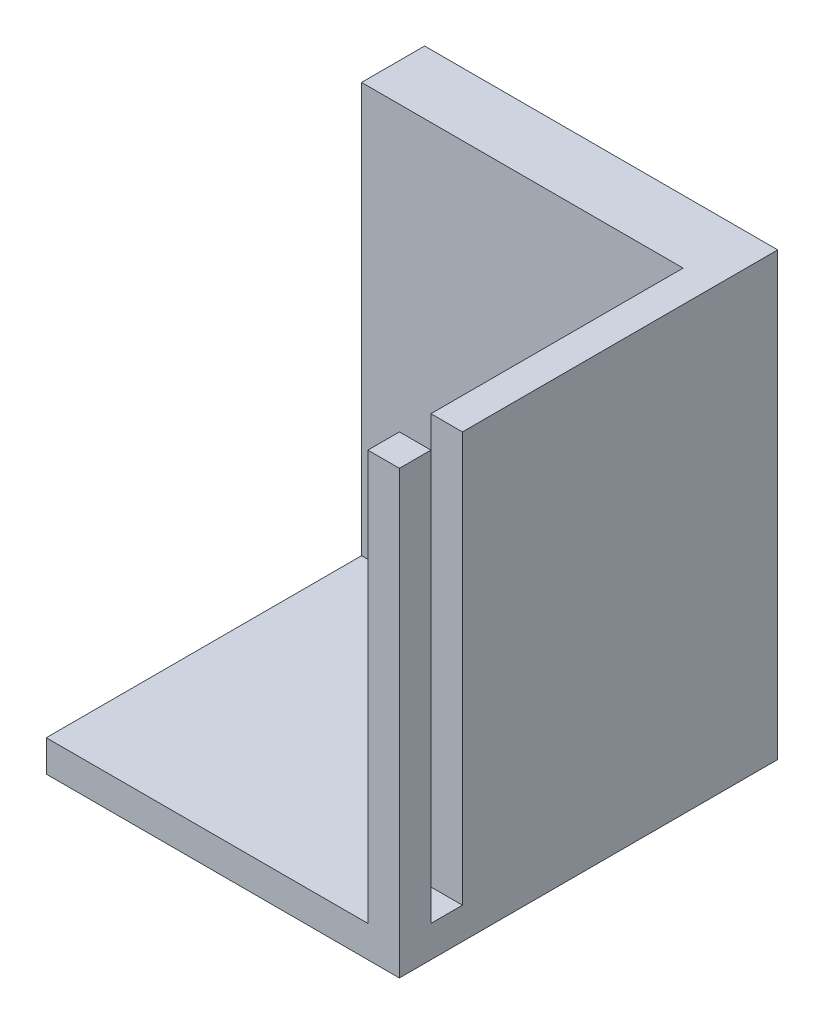
from build123d import *

# Parameters (mm, degrees)
SKETCH1_W                      = 670
SKETCH1_H                      = 120
BOSS_EXTRUDE1_DEPTH            = 530
SKETCH2_W                      = 100
SKETCH2_H                      = 200
SKETCH2_W_2                    = 650
SKETCH2_H_2                    = 250
CUT_EXTRUDE1_DEPTH             = 100
SKETCH3_R                      = 50
CUT_EXTRUDE2_DEPTH             = 260
F_12_0_12_DIAMETER_HOLE2_D     = 12
F_12_0_12_DIAMETER_HOLE2_DEPTH = 30
F_12_0_12_DIAMETER_HOLE2_TIP   = 3.605163714
SKETCH8_W                      = 650
SKETCH8_H                      = 50
BOSS_EXTRUDE2_DEPTH            = 5
SKETCH9_W                      = 10
SKETCH9_H                      = 250
CUT_EXTRUDE3_DEPTH             = 717
CUT_EXTRUDE4_DEPTH             = 5
SKETCH11_W                     = 10
SKETCH11_H                     = 100
BOSS_EXTRUDE3_DEPTH            = 78
BOSS_EXTRUDE3_2_DEPTH          = 78
BOSS_EXTRUDE3_3_DEPTH          = 78
SKETCH12_W                     = 20
SKETCH12_H                     = 30
CUT_EXTRUDE5_DEPTH             = 80
SKETCH15_W                     = 30
SKETCH15_H                     = 23.536156656
SKETCH15_H_2                   = 28.986603691
CUT_EXTRUDE7_DEPTH             = 35
SHELL1_T                       = -3
SKETCH16_W                     = 14
SKETCH16_H                     = 14
CUT_EXTRUDE8_DEPTH             = 35
SKETCH17_W                     = 5.729882812
SKETCH17_H                     = 17.428393554
SKETCH17_W_2                   = 13.369726562
SKETCH17_H_2                   = 3.342431641
BOSS_EXTRUDE4_DEPTH            = 5
CUT_EXTRUDE10_DEPTH            = 863.670273187
CUT_EXTRUDE10_DEPTH_BACK       = 863.670273187
SKETCH18_W                     = 670
SKETCH18_H                     = 250
CUT_EXTRUDE12_DEPTH            = 737.002717386
CUT_EXTRUDE12_DEPTH_BACK       = 737.002717386
SKETCH19_W                     = 558
SKETCH19_H                     = 280
CUT_EXTRUDE13_DEPTH            = 322.253793752
CUT_EXTRUDE13_DEPTH_BACK       = 322.253793752
SKETCH20_W                     = 120
SKETCH20_H                     = 140


with BuildPart() as part:
    # Sketch1 → Boss-Extrude1 (new body)
    with BuildSketch(Plane(origin=(0, 0, 0), x_dir=(1, 0, 0), z_dir=(0, 1, 0))):
        with Locations((335, 60)):
            Rectangle(SKETCH1_W, SKETCH1_H)
    extrude(amount=BOSS_EXTRUDE1_DEPTH)

    # Sketch2 → Cut-Extrude1 (cut)
    with BuildSketch(Plane.XY):
        with Locations((60, 380)):
            Rectangle(SKETCH2_W, SKETCH2_H)
        with Locations((170, 380)):
            Rectangle(SKETCH2_W, SKETCH2_H)
        with Locations((280, 380)):
            Rectangle(SKETCH2_W, SKETCH2_H)
        with Locations((390, 380)):
            Rectangle(SKETCH2_W, SKETCH2_H)
        with Locations((500, 380)):
            Rectangle(SKETCH2_W, SKETCH2_H)
        with Locations((610, 380)):
            Rectangle(SKETCH2_W, SKETCH2_H)
        with Locations((335, 135)):
            Rectangle(SKETCH2_W_2, SKETCH2_H_2)
    extrude(amount=-CUT_EXTRUDE1_DEPTH, mode=Mode.SUBTRACT)

    # Sketch3 → Cut-Extrude2 (cut)
    with BuildSketch(Plane(origin=(0, 530, 0), x_dir=(1, 0, 0), z_dir=(0, 1, 0))):
        with Locations(Location((60, 60, 0), (0, 0, 270))):
            Circle(SKETCH3_R)
        with Locations(Location((170, 60, 0), (0, 0, 270))):
            Circle(SKETCH3_R)
        with Locations(Location((280, 60, 0), (0, 0, 270))):
            Circle(SKETCH3_R)
        with Locations(Location((390, 60, 0), (0, 0, 270))):
            Circle(SKETCH3_R)
        with Locations(Location((500, 60, 0), (0, 0, 270))):
            Circle(SKETCH3_R)
        with Locations(Location((610, 60, 0), (0, 0, 270))):
            Circle(SKETCH3_R)
    extrude(amount=-CUT_EXTRUDE2_DEPTH, mode=Mode.SUBTRACT)

    # Ø12.0 (12) Diameter Hole2
    with Locations(Plane(origin=(59.704642413, 270, -102.411697903), x_dir=(0, 0, 1), z_dir=(0, 1, 0))):
        with Locations((0, 0), (-0.195888006, 111.8520513), (0.014838595, 221.167624818), (-0.341843303, 331.364008353), (0.657723149, 441.008646429), (1.288998006, 549.811854685)):
            Hole(F_12_0_12_DIAMETER_HOLE2_D / 2, depth=F_12_0_12_DIAMETER_HOLE2_DEPTH)
            with Locations((0, 0, -(F_12_0_12_DIAMETER_HOLE2_DEPTH + F_12_0_12_DIAMETER_HOLE2_TIP / 2))):  # 118° drill point
                Cone(0, F_12_0_12_DIAMETER_HOLE2_D / 2, F_12_0_12_DIAMETER_HOLE2_TIP, mode=Mode.SUBTRACT)

    # Sketch8 → Boss-Extrude2 (add)
    with BuildSketch(Plane.XY):
        with Locations((335, 305)):
            Rectangle(SKETCH8_W, SKETCH8_H)
    extrude(amount=-BOSS_EXTRUDE2_DEPTH)

    # Sketch9 → Cut-Extrude3 (cut)
    with BuildSketch(Plane(origin=(670, 0, 0), x_dir=(0, 0, -1), z_dir=(1, 0, 0))):
        with Locations((15, 135)):
            Rectangle(SKETCH9_W, SKETCH9_H)
    extrude(amount=-CUT_EXTRUDE3_DEPTH, mode=Mode.SUBTRACT)

    # Sketch10 → Cut-Extrude4 (cut)
    with BuildSketch(Plane(origin=(0, 10, 0), x_dir=(1, 0, 0), z_dir=(0, 1, 0))):
        Polygon((365, 61.943560596), (350, 87.924322709), (320, 87.924322709), (305, 61.943560596), (320, 35.962798482), (350, 35.962798482), align=None)
    extrude(amount=-CUT_EXTRUDE4_DEPTH, mode=Mode.SUBTRACT)

    # Sketch12 → Cut-Extrude5 (cut)
    with BuildSketch(Plane.XY.offset(-100)):
        with Locations((85.198613037, 245)):
            Rectangle(SKETCH12_W, SKETCH12_H)
        with Locations((195.198613037, 245)):
            Rectangle(SKETCH12_W, SKETCH12_H)
        with Locations((305.198613037, 245)):
            Rectangle(SKETCH12_W, SKETCH12_H)
        with Locations((415.198613037, 245)):
            Rectangle(SKETCH12_W, SKETCH12_H)
        with Locations((525.198613037, 245)):
            Rectangle(SKETCH12_W, SKETCH12_H)
        with Locations((635.198613037, 245)):
            Rectangle(SKETCH12_W, SKETCH12_H)
    extrude(amount=-CUT_EXTRUDE5_DEPTH, mode=Mode.SUBTRACT)

    # Sketch17 → Boss-Extrude4 (add)
    # profile 1 of 9: a face of its own
    with BuildSketch(Plane.XY):
        with BuildLine():
            Line((527.508830928, 289.835452458), (527.508830928, 307.263846012))
            Line((527.508830928, 307.263846012), (534.861434459, 307.263846012))
            add(Edge.make_bspline(
                [(534.861434459, 307.263846012), (535.181337774, 307.258256848), (535.803061116, 307.24739446), (536.703508491, 307.139069344), (537.544992916, 306.975202489), (538.325061607, 306.737496792), (539.040841948, 306.426020155), (539.698044515, 306.051894954), (540.290333057, 305.605079277), (540.822348212, 305.090232636), (541.284521701, 304.502523111), (541.692171296, 303.852565801), (542.030284458, 303.129762281), (542.309377095, 302.341316546), (542.5243908, 301.484161689), (542.679660381, 300.560045938), (542.773357357, 299.567500804), (542.783368073, 298.883107022), (542.788518428, 298.530997273)],
                knots=[0, 0, 0, 0, 1.135059408, 2.20595691, 3.214417064, 4.174978569, 5.094187092, 5.980001006, 6.853065862, 7.720814779, 8.600404634, 9.50058483, 10.438414914, 11.426825708, 12.465239141, 13.571113463, 14.750376389, 16, 16, 16, 16], degree=3))
            add(Edge.make_bspline(
                [(542.788518428, 298.530997273), (542.781740751, 298.180151665), (542.768592871, 297.499553336), (542.676885992, 296.511518461), (542.516733301, 295.591080531), (542.296748778, 294.736450427), (542.003051046, 293.953120444), (541.654236167, 293.233205539), (541.233025793, 292.585291498), (540.753136904, 292.000029304), (540.204772188, 291.484681411), (539.587651059, 291.044279297), (538.910779309, 290.668464036), (538.169670382, 290.361903209), (537.364073889, 290.124869172), (536.495133477, 289.954199984), (535.562644449, 289.853487388), (534.920131033, 289.841584621), (534.58911581, 289.835452458)],
                knots=[0, 0, 0, 0, 1.228418252, 2.382983832, 3.470276728, 4.496757894, 5.468023682, 6.394867725, 7.292157164, 8.167372942, 9.039072913, 9.918728341, 10.815246345, 11.744296628, 12.720973084, 13.750736166, 14.841206188, 16, 16, 16, 16], degree=3))
            Line((534.58911581, 289.835452458), (527.508830928, 289.835452458))
        make_face()
        with BuildLine():
            Line((533.238713741, 291.745413395), (534.048208904, 291.745413395))
            add(Edge.make_bspline(
                [(534.048208904, 291.745413395), (534.172894012, 291.749291978), (534.413033311, 291.756761998), (534.758676231, 291.825976613), (535.075745017, 291.938271137), (535.365749176, 292.094802589), (535.623404602, 292.300450923), (535.848862806, 292.551404902), (536.04776914, 292.844737637), (536.217685755, 293.190205032), (536.364284647, 293.596533622), (536.481764702, 294.076367921), (536.592118304, 294.630928744), (536.673672739, 295.265507643), (536.740044562, 295.978448886), (536.788346679, 296.768428292), (536.812018936, 297.636801208), (536.817188964, 298.241258393), (536.819890499, 298.55711002)],
                knots=[0, 0, 0, 0, 0.728710832, 1.403472396, 2.052289494, 2.690292559, 3.321919393, 3.970736491, 4.656696891, 5.388631723, 6.217040872, 7.17856157, 8.275589967, 9.523440737, 10.918935818, 12.463926104, 14.152268318, 16, 16, 16, 16], degree=3))
            add(Edge.make_bspline(
                [(536.819890499, 298.55711002), (536.8171426, 298.871715251), (536.811863063, 299.476166083), (536.7886758, 300.343334385), (536.739579947, 301.133216935), (536.674703848, 301.843934916), (536.589660404, 302.476324031), (536.488366458, 303.031681737), (536.362441588, 303.507627045), (536.222158727, 303.914921549), (536.050140993, 304.256514038), (535.858357073, 304.554097881), (535.62547107, 304.79746827), (535.36991257, 305.004888479), (535.079348843, 305.160875844), (534.761320266, 305.273944358), (534.414185903, 305.34216807), (534.172870641, 305.349893944), (534.048208904, 305.353885075)],
                knots=[0, 0, 0, 0, 1.842836665, 3.540640921, 5.080358154, 6.47765669, 7.719902824, 8.816971715, 9.781579111, 10.601733135, 11.334613876, 12.017393917, 12.666641099, 13.29908421, 13.937911793, 14.587567384, 15.270347425, 16, 16, 16, 16], degree=3))
            Line((534.048208904, 305.353885075), (533.238713741, 305.353885075))
            Line((533.238713741, 305.353885075), (533.238713741, 291.745413395))
        make_face(mode=Mode.SUBTRACT)
    # profile 2 of 9: a face of its own
    with BuildSketch(Plane.XY):
        with Locations((547.563420772, 298.549649235)):
            Rectangle(SKETCH17_W, SKETCH17_H)
    # profile 3 of 9: a face of its own
    with BuildSketch(Plane.XY):
        Polygon((564.514324092, 307.263846012), (564.514324092, 305.115139958), (558.545696163, 305.115139958), (558.545696163, 299.862747379), (563.559343624, 299.862747379), (563.559343624, 297.714041325), (558.545696163, 297.714041325), (558.545696163, 289.835452458), (552.81581335, 289.835452458), (552.81581335, 307.263846012), align=None)
    # profile 4 of 9: a face of its own
    with BuildSketch(Plane.XY):
        Polygon((577.645305538, 307.263846012), (577.645305538, 305.115139958), (571.676677608, 305.115139958), (571.676677608, 299.862747379), (576.690325069, 299.862747379), (576.690325069, 297.714041325), (571.676677608, 297.714041325), (571.676677608, 289.835452458), (565.946794795, 289.835452458), (565.946794795, 307.263846012), align=None)
    # profile 5 of 9: a face of its own
    with BuildSketch(Plane.XY):
        with Locations((584.330168819, 287.448001286)):
            Rectangle(SKETCH17_W_2, SKETCH17_H_2)
    # profile 6 of 9: a face of its own
    with BuildSketch(Plane.XY):
        with BuildLine():
            Line((605.578484249, 307.263846012), (605.578484249, 295.602639195))
            add(Edge.make_bspline(
                [(605.578484249, 295.602639195), (605.574209777, 295.35989389), (605.565919345, 294.889083964), (605.480877158, 294.20653885), (605.349958188, 293.569747554), (605.15926554, 292.978838165), (604.911867049, 292.436847071), (604.616163877, 291.936663973), (604.260702644, 291.487723021), (603.847299908, 291.08966617), (603.386881991, 290.731670113), (602.867295001, 290.425440037), (602.293741958, 290.168488385), (601.66690529, 289.960990771), (600.988052682, 289.797299786), (600.254912883, 289.679078851), (599.467035781, 289.60781007), (598.923618241, 289.60048219), (598.643684673, 289.59670734)],
                knots=[0, 0, 0, 0, 1.108173197, 2.149326602, 3.136215123, 4.073726706, 4.978516626, 5.852185058, 6.72141202, 7.584905625, 8.467554395, 9.379216169, 10.332422268, 11.332766067, 12.390653242, 13.518530507, 14.721707419, 16, 16, 16, 16], degree=3))
            add(Edge.make_bspline(
                [(598.643684673, 289.59670734), (598.373688491, 289.600411437), (597.851346557, 289.607577482), (597.093280473, 289.679448684), (596.387523889, 289.797736542), (595.733050135, 289.960122315), (595.130189942, 290.169220301), (594.579048171, 290.42623041), (594.078350789, 290.732835498), (593.633858028, 291.090104794), (593.234289459, 291.486851767), (592.899913678, 291.940746827), (592.609043638, 292.435866034), (592.375223767, 292.980322997), (592.191754821, 293.570441519), (592.063541006, 294.20666921), (591.983676196, 294.889343196), (591.974661767, 295.359932437), (591.970012569, 295.602639195)],
                knots=[0, 0, 0, 0, 1.258901956, 2.435505865, 3.547148904, 4.59359074, 5.576649289, 6.5183682, 7.424469602, 8.307507093, 9.172751023, 10.042627298, 10.928839176, 11.845659241, 12.799442865, 13.80597989, 14.868432463, 16, 16, 16, 16], degree=3))
            Line((591.970012569, 295.602639195), (591.970012569, 307.263846012))
            Line((591.970012569, 307.263846012), (597.699895381, 307.263846012))
            Line((597.699895381, 307.263846012), (597.699895381, 295.457153889))
            add(Edge.make_bspline(
                [(597.699895381, 295.457153889), (597.700816195, 295.287996189), (597.702584578, 294.963135903), (597.729908723, 294.499051493), (597.768241004, 294.079064133), (597.828226169, 293.705517832), (597.90066041, 293.377063412), (597.989882091, 293.09281535), (598.094998068, 292.852496478), (598.225239063, 292.654232043), (598.380826623, 292.495135011), (598.55368342, 292.353231761), (598.757556996, 292.238543846), (598.987648905, 292.146224908), (599.243380948, 292.070549638), (599.526120553, 292.020376099), (599.83553351, 291.990763905), (600.049971942, 291.986424568), (600.161954402, 291.984158512)],
                knots=[0, 0, 0, 0, 1.622370975, 3.115695595, 4.458049099, 5.666011203, 6.742434742, 7.681714947, 8.519814998, 9.250928664, 9.942747364, 10.646898194, 11.389596108, 12.175933929, 13.021386247, 13.943159715, 14.925891993, 16, 16, 16, 16], degree=3))
            add(Edge.make_bspline(
                [(600.161954402, 291.984158512), (600.283927219, 291.987190593), (600.521124756, 291.993087005), (600.86597014, 292.03390861), (601.187714881, 292.103380086), (601.484890424, 292.205377303), (601.758665297, 292.332852529), (602.012761516, 292.484567923), (602.236391413, 292.674631152), (602.439076761, 292.888441291), (602.620738276, 293.128529789), (602.771757722, 293.399928575), (602.905501548, 293.697121508), (603.005823683, 294.025060118), (603.089837826, 294.379999499), (603.146989706, 294.763086929), (603.186210275, 295.174074524), (603.189394751, 295.457053988), (603.191033077, 295.602639195)],
                knots=[0, 0, 0, 0, 1.083870311, 2.107775948, 3.08105344, 4.003637981, 4.893545291, 5.761570557, 6.624657808, 7.49233129, 8.376387281, 9.291996285, 10.246843261, 11.267344133, 12.334180325, 13.486053461, 14.706643157, 16, 16, 16, 16], degree=3))
            Line((603.191033077, 295.602639195), (603.191033077, 307.263846012))
            Line((603.191033077, 307.263846012), (605.578484249, 307.263846012))
        make_face()
    # profile 7 of 9: a face of its own
    with BuildSketch(Plane.XY):
        with BuildLine():
            Line((619.731593227, 302.015183827), (616.739818477, 301.526502415))
            add(Edge.make_bspline(
                [(616.739818477, 301.526502415), (616.748849224, 301.670726223), (616.765660669, 301.939210177), (616.78429066, 302.312269209), (616.796668381, 302.625642376), (616.798628236, 302.814722915), (616.799504756, 302.899286839)],
                knots=[0, 0, 0, 0, 1.261802504, 2.348944521, 3.261585937, 4, 4, 4, 4], degree=3))
            add(Edge.make_bspline(
                [(616.799504756, 302.899286839), (616.798306068, 303.007660677), (616.795968139, 303.219033721), (616.750451916, 303.523894877), (616.694806916, 303.811547356), (616.604352699, 304.076787391), (616.488181329, 304.320314265), (616.348943917, 304.543955606), (616.184187178, 304.745078709), (615.995833421, 304.928129987), (615.778009957, 305.083200131), (615.536269472, 305.218702836), (615.269765326, 305.333844758), (614.978065514, 305.431346685), (614.660683072, 305.504624438), (614.319025281, 305.556776695), (613.952471696, 305.585673441), (613.699597795, 305.590260771), (613.568984889, 305.592630192)],
                knots=[0, 0, 0, 0, 1.079280541, 2.105035848, 3.067950317, 3.99715044, 4.889989748, 5.753421302, 6.617030865, 7.476358039, 8.364190572, 9.274590025, 10.235106994, 11.254473582, 12.337095886, 13.478601727, 14.697662529, 16, 16, 16, 16], degree=3))
            add(Edge.make_bspline(
                [(613.568984889, 305.592630192), (613.391954632, 305.58912286), (613.059112606, 305.582528579), (612.595688488, 305.495339748), (612.198743126, 305.361419257), (611.87165349, 305.163811893), (611.613188167, 304.909795747), (611.433841092, 304.593316589), (611.323009072, 304.224665915), (611.313400221, 303.959558324), (611.308367061, 303.820693775)],
                knots=[0, 0, 0, 0, 1.294917039, 2.43462794, 3.440028966, 4.347597256, 5.210608309, 6.06356377, 6.985685997, 8, 8, 8, 8], degree=3))
            add(Edge.make_bspline(
                [(611.308367061, 303.820693775), (611.317562032, 303.705133219), (611.336106628, 303.472068433), (611.47315858, 303.132808312), (611.695999602, 302.811560885), (612.009295906, 302.510664216), (612.404107796, 302.221967273), (612.884407504, 301.948533431), (613.450813789, 301.688189695), (613.862519081, 301.536023727), (614.080048656, 301.455624958)],
                knots=[0, 0, 0, 0, 0.716839541, 1.445735977, 2.240793036, 3.131329288, 4.131129903, 5.273471266, 6.559404876, 8, 8, 8, 8], degree=3))
            add(Edge.make_bspline(
                [(614.080048656, 301.455624958), (614.335934702, 301.364918412), (614.834564244, 301.188164095), (615.547657928, 300.88707802), (616.213068388, 300.5749594), (616.829579094, 300.246613346), (617.397833174, 299.90520698), (617.914851624, 299.544556457), (618.386199073, 299.173962102), (618.807001026, 298.783874588), (619.177995113, 298.378100064), (619.4958685, 297.952745357), (619.771807525, 297.51723103), (619.991113975, 297.061458502), (620.169645242, 296.594624218), (620.292698657, 296.11024444), (620.364288243, 295.609761088), (620.37516617, 295.270864226), (620.380681514, 295.099036213)],
                knots=[0, 0, 0, 0, 1.359488612, 2.649152603, 3.874964776, 5.039588756, 6.146130126, 7.193090393, 8.194917302, 9.146793662, 10.063845301, 10.944476293, 11.803344532, 12.641736646, 13.473440096, 14.302714936, 15.139439897, 16, 16, 16, 16], degree=3))
            add(Edge.make_bspline(
                [(620.380681514, 295.099036213), (620.374476075, 294.902306495), (620.362285176, 294.515820995), (620.280160209, 293.948630617), (620.138011896, 293.409496554), (619.938489338, 292.895972278), (619.681049879, 292.411946655), (619.366518754, 291.954381076), (618.996510229, 291.525099427), (618.5710008, 291.128381035), (618.102222518, 290.765302239), (617.587803957, 290.450854345), (617.034458515, 290.187092261), (616.444107988, 289.968993032), (615.81453624, 289.801373099), (615.145337453, 289.685291013), (614.438790193, 289.606619894), (613.954683001, 289.600062276), (613.70700941, 289.59670734)],
                knots=[0, 0, 0, 0, 0.972121714, 1.909782367, 2.824924061, 3.721832975, 4.62620438, 5.527836938, 6.46026819, 7.421000932, 8.398101015, 9.385579713, 10.394244048, 11.422703992, 12.491421888, 13.608778581, 14.776629625, 16, 16, 16, 16], degree=3))
            add(Edge.make_bspline(
                [(613.70700941, 289.59670734), (613.445745367, 289.599650312), (612.939893069, 289.605348413), (612.207608113, 289.66709241), (611.525297432, 289.760984454), (610.893395078, 289.899706116), (610.309273131, 290.072394336), (609.776099392, 290.288320955), (609.295310255, 290.547303481), (608.863217672, 290.843007892), (608.478306623, 291.175775461), (608.148120946, 291.551766865), (607.86942369, 291.967163224), (607.639947144, 292.421521488), (607.466477665, 292.917583541), (607.339164663, 293.449829748), (607.264537999, 294.021332449), (607.254747521, 294.414908557), (607.249700069, 294.617815586)],
                knots=[0, 0, 0, 0, 1.342201143, 2.598733168, 3.773451092, 4.878874364, 5.91991243, 6.900006476, 7.829142054, 8.72062616, 9.585588575, 10.436728592, 11.283829734, 12.149664931, 13.044964919, 13.977937424, 14.957531465, 16, 16, 16, 16], degree=3))
            add(Edge.make_bspline(
                [(607.249700069, 294.617815586), (607.250803815, 294.692425759), (607.253213998, 294.855347393), (607.260452266, 295.122772538), (607.275636683, 295.433682216), (607.29037174, 295.656130545), (607.298195171, 295.774237248)],
                knots=[0, 0, 0, 0, 0.773500207, 1.689044709, 2.77302154, 4, 4, 4, 4], degree=3))
            Line((607.298195171, 295.774237248), (610.36457777, 296.337526509))
            add(Edge.make_bspline(
                [(610.36457777, 296.337526509), (610.326952988, 296.136337493), (610.255606535, 295.754830366), (610.178678473, 295.21219969), (610.124206629, 294.733311493), (610.11767002, 294.435147371), (610.114641475, 294.297001835)],
                knots=[0, 0, 0, 0, 1.192988372, 2.262218769, 3.194850416, 4, 4, 4, 4], degree=3))
            add(Edge.make_bspline(
                [(610.114641475, 294.297001835), (610.116191817, 294.183708768), (610.119182568, 293.965156219), (610.159053378, 293.648552813), (610.215988606, 293.352999663), (610.302906772, 293.079707227), (610.411206928, 292.826307836), (610.544682453, 292.59538211), (610.704385489, 292.386485019), (610.887496571, 292.200099922), (611.094689168, 292.033628705), (611.327456494, 291.892756696), (611.58347653, 291.771733922), (611.864681562, 291.677479524), (612.167961721, 291.596080628), (612.497219749, 291.548235723), (612.849461228, 291.512043782), (613.092629543, 291.508500084), (613.218327999, 291.506668278)],
                knots=[0, 0, 0, 0, 1.135776692, 2.191015738, 3.19649269, 4.151244236, 5.061952528, 5.956281389, 6.819534407, 7.692823504, 8.571441916, 9.478554956, 10.416037156, 11.406231466, 12.450054172, 13.561596327, 14.739541482, 16, 16, 16, 16], degree=3))
            add(Edge.make_bspline(
                [(613.218327999, 291.506668278), (613.423996012, 291.510791273), (613.810619321, 291.518541853), (614.349272542, 291.616708407), (614.810575885, 291.768742445), (615.189785268, 291.991387532), (615.490778961, 292.278756613), (615.698005174, 292.637320004), (615.824813318, 293.05638326), (615.837728413, 293.355975238), (615.844524288, 293.513619419)],
                knots=[0, 0, 0, 0, 1.308765556, 2.460272085, 3.475015317, 4.388076298, 5.239673503, 6.095681635, 6.997954785, 8, 8, 8, 8], degree=3))
            add(Edge.make_bspline(
                [(615.844524288, 293.513619419), (615.833808824, 293.638242951), (615.811807312, 293.894126055), (615.644884004, 294.264515838), (615.382382362, 294.620631473), (615.016807277, 294.962984909), (614.551376589, 295.293471235), (613.986957743, 295.616730224), (613.322148235, 295.933112033), (612.83677959, 296.119639164), (612.580430889, 296.21815395)],
                knots=[0, 0, 0, 0, 0.667930748, 1.371427933, 2.146459016, 3.034714139, 4.04893387, 5.207327294, 6.525042705, 8, 8, 8, 8], degree=3))
            add(Edge.make_bspline(
                [(612.580430889, 296.21815395), (612.374354345, 296.29679374), (611.970646869, 296.450850434), (611.394079385, 296.713586304), (610.853066711, 296.987016804), (610.357486361, 297.288235735), (609.896382561, 297.599610528), (609.477036946, 297.932256792), (609.09841673, 298.284556341), (608.758710772, 298.653375077), (608.457302107, 299.038989264), (608.199448649, 299.444659231), (607.977533299, 299.866789834), (607.798609588, 300.308107488), (607.65975715, 300.767821241), (607.559616231, 301.244439392), (607.497905054, 301.739995674), (607.491630423, 302.075933546), (607.488445186, 302.246468159)],
                knots=[0, 0, 0, 0, 1.249558333, 2.447906163, 3.58867143, 4.682264114, 5.731748367, 6.739728761, 7.711906036, 8.659384707, 9.578321416, 10.481344598, 11.379544271, 12.277135726, 13.175418307, 14.097160112, 15.034047388, 16, 16, 16, 16], degree=3))
            add(Edge.make_bspline(
                [(607.488445186, 302.246468159), (607.49282555, 302.439538736), (607.501402184, 302.817565692), (607.587451154, 303.36980586), (607.719291893, 303.894921371), (607.910558542, 304.389343064), (608.156192894, 304.852853762), (608.453187669, 305.288766511), (608.804241719, 305.697593471), (609.213503754, 306.066686531), (609.657214714, 306.407618241), (610.14376173, 306.697651931), (610.658716537, 306.950861947), (611.210636666, 307.148827868), (611.791820619, 307.313252612), (612.408080529, 307.421140415), (613.056315391, 307.490701612), (613.499160755, 307.498567824), (613.725661373, 307.502591129)],
                knots=[0, 0, 0, 0, 1.01033566, 1.978209831, 2.919499157, 3.840961976, 4.746855014, 5.660740114, 6.597989116, 7.56120833, 8.541877795, 9.523498025, 10.522416858, 11.542172371, 12.589598349, 13.681636521, 14.814234488, 16, 16, 16, 16], degree=3))
            add(Edge.make_bspline(
                [(613.725661373, 307.502591129), (613.968269855, 307.498219033), (614.438190994, 307.489750488), (615.120391152, 307.426787419), (615.755073228, 307.319142339), (616.345153155, 307.171557286), (616.887304575, 306.977590666), (617.384933999, 306.742393454), (617.834452216, 306.46201507), (618.236961315, 306.139451502), (618.593086714, 305.773322851), (618.897467704, 305.361641069), (619.158701245, 304.909408454), (619.366684143, 304.412232174), (619.529870326, 303.873247147), (619.649133834, 303.29158184), (619.720420497, 302.667301443), (619.72779778, 302.236712324), (619.731593227, 302.015183827)],
                knots=[0, 0, 0, 0, 1.248314423, 2.417925914, 3.521398822, 4.558068205, 5.543720209, 6.479599284, 7.385061127, 8.263440163, 9.127722873, 10.00561236, 10.891325273, 11.808802823, 12.772251995, 13.784947978, 14.860405143, 16, 16, 16, 16], degree=3))
        make_face()
    # profile 8 of 9: a face of its own
    with BuildSketch(Plane.XY):
        Polygon((633.989153194, 307.263846012), (633.989153194, 305.115139958), (628.020525264, 305.115139958), (628.020525264, 300.340237614), (633.034172725, 300.340237614), (633.034172725, 298.191531559), (628.020525264, 298.191531559), (628.020525264, 291.984158512), (634.944133663, 291.984158512), (634.944133663, 289.835452458), (622.290642452, 289.835452458), (622.290642452, 307.263846012), align=None)
    # profile 9 of 9: a face of its own
    with BuildSketch(Plane.XY):
        with BuildLine():
            Line((636.376604366, 289.835452458), (636.376604366, 307.263846012))
            Line((636.376604366, 307.263846012), (643.990335369, 307.263846012))
            add(Edge.make_bspline(
                [(643.990335369, 307.263846012), (644.237946498, 307.261150834), (644.721600887, 307.25588639), (645.426490561, 307.189203683), (646.094808274, 307.090496236), (646.724915796, 306.949857504), (647.317873659, 306.767252686), (647.871119087, 306.542146), (648.390701058, 306.282329135), (648.864494846, 305.976472528), (649.295093616, 305.642889252), (649.669668547, 305.279483604), (649.990389523, 304.894749072), (650.250664962, 304.483256345), (650.454275633, 304.048690948), (650.59581384, 303.587791605), (650.684089268, 303.104102537), (650.695510601, 302.772834174), (650.701311397, 302.604585835)],
                knots=[0, 0, 0, 0, 1.303269877, 2.545653735, 3.724355284, 4.8584284, 5.941462088, 6.987020715, 8.000098032, 8.995332524, 9.951400474, 10.863507538, 11.737823931, 12.582415999, 13.420128714, 14.25671499, 15.114600608, 16, 16, 16, 16], degree=3))
            add(Edge.make_bspline(
                [(650.701311397, 302.604585835), (650.698282873, 302.472674957), (650.692382063, 302.215658276), (650.651041486, 301.838684287), (650.580643818, 301.480313933), (650.481036683, 301.139915259), (650.347814833, 300.820175594), (650.191279492, 300.517863507), (650.009772227, 300.230553342), (649.788675198, 299.970497982), (649.548268341, 299.722842359), (649.274558803, 299.497116911), (648.974487035, 299.288655528), (648.642526299, 299.104010513), (648.287619671, 298.928055749), (647.899038177, 298.784921972), (647.486819978, 298.644749395), (647.19793098, 298.577036306), (647.049257183, 298.54218845)],
                knots=[0, 0, 0, 0, 1.057156483, 2.059775939, 3.035078039, 3.981068617, 4.897189472, 5.80650904, 6.70770952, 7.613691521, 8.536886357, 9.470937334, 10.45233069, 11.461024139, 12.51295332, 13.623444893, 14.776929983, 16, 16, 16, 16], degree=3))
            add(Edge.make_bspline(
                [(647.049257183, 298.54218845), (647.19164695, 298.499279419), (647.467865022, 298.416041346), (647.856360945, 298.265600017), (648.211652989, 298.111536308), (648.524185739, 297.936781388), (648.807636894, 297.762122504), (649.047122259, 297.564301324), (649.255235567, 297.361673563), (649.425188343, 297.135464734), (649.570253643, 296.882344437), (649.694827156, 296.586596707), (649.815179167, 296.247423665), (649.917667348, 295.859098311), (650.004750555, 295.423699276), (650.088222437, 294.944027189), (650.153853601, 294.416024546), (650.187587341, 294.048412906), (650.2051692, 293.856815525)],
                knots=[0, 0, 0, 0, 1.149282524, 2.229462177, 3.219229774, 4.139917433, 4.995948464, 5.788695735, 6.536448429, 7.236319808, 7.968460079, 8.78645307, 9.713791991, 10.749194692, 11.887975363, 13.146018663, 14.512518948, 16, 16, 16, 16], degree=3))
            add(Edge.make_bspline(
                [(650.2051692, 293.856815525), (650.225980287, 293.627849833), (650.265975604, 293.187817268), (650.348933081, 292.554613589), (650.44386163, 291.974357025), (650.555874504, 291.44528724), (650.681301216, 290.967898855), (650.821280597, 290.540469593), (650.979920039, 290.165788217), (651.10484481, 289.941461656), (651.163880062, 289.835452458)],
                knots=[0, 0, 0, 0, 1.324580516, 2.545615266, 3.678710841, 4.711533017, 5.660403917, 6.521349952, 7.301239649, 8, 8, 8, 8], degree=3))
            Line((651.163880062, 289.835452458), (645.213904094, 289.835452458))
            add(Edge.make_bspline(
                [(645.213904094, 289.835452458), (645.12229736, 290.069847279), (644.935171241, 290.548648246), (644.7595281, 291.319414791), (644.64846922, 292.142514735), (644.635117598, 292.70994511), (644.628232479, 293.002555653)],
                knots=[0, 0, 0, 0, 0.930410518, 1.900560147, 2.917368081, 4, 4, 4, 4], degree=3))
            Line((644.628232479, 293.002555653), (644.605850124, 294.002300831))
            Line((644.605850124, 294.002300831), (644.579737377, 295.266903874))
            add(Edge.make_bspline(
                [(644.579737377, 295.266903874), (644.573694669, 295.477395004), (644.562357007, 295.872330118), (644.469348432, 296.426164013), (644.30178735, 296.894645884), (644.073222546, 297.287223005), (643.766741442, 297.590613479), (643.39104803, 297.804152917), (642.950456912, 297.93396284), (642.634664848, 297.946292392), (642.468335247, 297.952786442)],
                knots=[0, 0, 0, 0, 1.295300309, 2.430314163, 3.439929415, 4.342995669, 5.203512789, 6.060756153, 6.978588463, 8, 8, 8, 8], degree=3))
            Line((642.468335247, 297.952786442), (642.106487178, 297.952786442))
            Line((642.106487178, 297.952786442), (642.106487178, 289.835452458))
            Line((642.106487178, 289.835452458), (636.376604366, 289.835452458))
        make_face()
        with BuildLine():
            Line((642.106487178, 299.862747379), (642.617550945, 299.862747379))
            add(Edge.make_bspline(
                [(642.617550945, 299.862747379), (642.722054451, 299.865172716), (642.925280724, 299.869889229), (643.220054897, 299.898289891), (643.494111408, 299.951809873), (643.749840966, 300.021017819), (643.984372137, 300.114851792), (644.200147241, 300.225818296), (644.391160406, 300.362685327), (644.565327067, 300.516342321), (644.718148635, 300.691986294), (644.850351299, 300.889034217), (644.961199162, 301.106225057), (645.056078491, 301.342818683), (645.125883912, 301.600830857), (645.173262731, 301.879472914), (645.203404658, 302.177423605), (645.207875435, 302.383174491), (645.210173702, 302.488943669)],
                knots=[0, 0, 0, 0, 1.184986479, 2.304423995, 3.352332712, 4.347714965, 5.303263624, 6.211353909, 7.091434645, 7.960150225, 8.839440182, 9.723126897, 10.64371617, 11.599264829, 12.608232147, 13.667459739, 14.800924404, 16, 16, 16, 16], degree=3))
            add(Edge.make_bspline(
                [(645.210173702, 302.488943669), (645.207875435, 302.594712847), (645.203404658, 302.800463732), (645.173262731, 303.098414423), (645.125883912, 303.37705648), (645.056078491, 303.635068654), (644.961199162, 303.87166228), (644.850351299, 304.08885312), (644.718148635, 304.285901043), (644.565327067, 304.461545017), (644.391160406, 304.61520201), (644.200147241, 304.752069041), (643.984372137, 304.863035546), (643.749840966, 304.956869518), (643.494111408, 305.026077464), (643.220054897, 305.079597446), (642.925280724, 305.107998108), (642.722054451, 305.112714621), (642.617550945, 305.115139958)],
                knots=[0, 0, 0, 0, 1.199075596, 2.332540261, 3.391767853, 4.400735171, 5.35628383, 6.276873103, 7.160559818, 8.039849775, 8.908565355, 9.788646091, 10.696736376, 11.652285035, 12.647667288, 13.695576005, 14.815013521, 16, 16, 16, 16], degree=3))
            Line((642.617550945, 305.115139958), (642.106487178, 305.115139958))
            Line((642.106487178, 305.115139958), (642.106487178, 299.862747379))
        make_face(mode=Mode.SUBTRACT)
    extrude(amount=BOSS_EXTRUDE4_DEPTH)

    # Sketch18 → Cut-Extrude10 (cut, two sides: drawn at the far end of the back side and taken through both)
    with BuildSketch(Plane.XY.offset(-CUT_EXTRUDE10_DEPTH_BACK)):
        with Locations((335, 405)):
            Rectangle(SKETCH18_W, SKETCH18_H)
    extrude(amount=CUT_EXTRUDE10_DEPTH + CUT_EXTRUDE10_DEPTH_BACK, mode=Mode.SUBTRACT)

    # Sketch19 → Cut-Extrude12 (cut, two sides: drawn at the far end of the back side and taken through both)
    with BuildSketch(Plane(origin=(0, 0, -120), x_dir=(-1, 0, 0), z_dir=(0, 0, -1)).offset(-CUT_EXTRUDE12_DEPTH_BACK)):
        with Locations((-279, 140)):
            Rectangle(SKETCH19_W, SKETCH19_H)
    extrude(amount=CUT_EXTRUDE12_DEPTH + CUT_EXTRUDE12_DEPTH_BACK, mode=Mode.SUBTRACT)

    # Sketch20 → Cut-Extrude13 (cut, two sides: drawn at the far end of the back side and taken through both)
    with BuildSketch(Plane.ZY.offset(-660).offset(-CUT_EXTRUDE13_DEPTH_BACK)):
        with Locations((-60, 210)):
            Rectangle(SKETCH20_W, SKETCH20_H)
    extrude(amount=CUT_EXTRUDE13_DEPTH + CUT_EXTRUDE13_DEPTH_BACK, mode=Mode.SUBTRACT)


with BuildPart() as body_2:
    # Sketch11 → Boss-Extrude3 (new body)
    with BuildSketch(Plane.XY.offset(-100)):
        with Locations((255, 60)):
            Rectangle(SKETCH11_W, SKETCH11_H)
    extrude(amount=BOSS_EXTRUDE3_DEPTH)


with BuildPart() as body_3:
    # Sketch11 → Boss-Extrude3 2 (new body)
    with BuildSketch(Plane.XY.offset(-100)):
        with Locations((415, 60)):
            Rectangle(SKETCH11_W, SKETCH11_H)
    extrude(amount=BOSS_EXTRUDE3_2_DEPTH)


with BuildPart() as body_4:
    # Sketch11 → Boss-Extrude3 3 (new body)
    with BuildSketch(Plane.XY.offset(-100)):
        Polygon((25, 198.45686471), (325, 145.558770497), (325, 122.01775856), (345, 122.01775856), (345, 145.558770497), (645, 198.45686471), align=None)
    extrude(amount=BOSS_EXTRUDE3_3_DEPTH)

    # Sketch15 → Cut-Extrude7 (cut)
    with BuildSketch(Plane(origin=(345, 0, 0), x_dir=(0, 0, -1), z_dir=(1, 0, 0))):
        with Locations((35, 133.231921672)):
            Rectangle(SKETCH15_W, SKETCH15_H)
        with Locations((85, 130.506698154)):
            Rectangle(SKETCH15_W, SKETCH15_H_2)
    extrude(amount=-CUT_EXTRUDE7_DEPTH, mode=Mode.SUBTRACT)

    # Shell1
    shell1_openings = [body_4.faces().sort_by_distance(p)[0] for p in [
        (335, 198.45686471, -61),
    ]]
    offset(amount=SHELL1_T, openings=shell1_openings, kind=Kind.INTERSECTION)

    # Sketch16 → Cut-Extrude8 (cut)
    with BuildSketch(Plane.XZ.offset(-122.01775856)):
        with Locations((335, -60)):
            Rectangle(SKETCH16_W, SKETCH16_H)
    extrude(amount=-CUT_EXTRUDE8_DEPTH, mode=Mode.SUBTRACT)


solid = part.part
